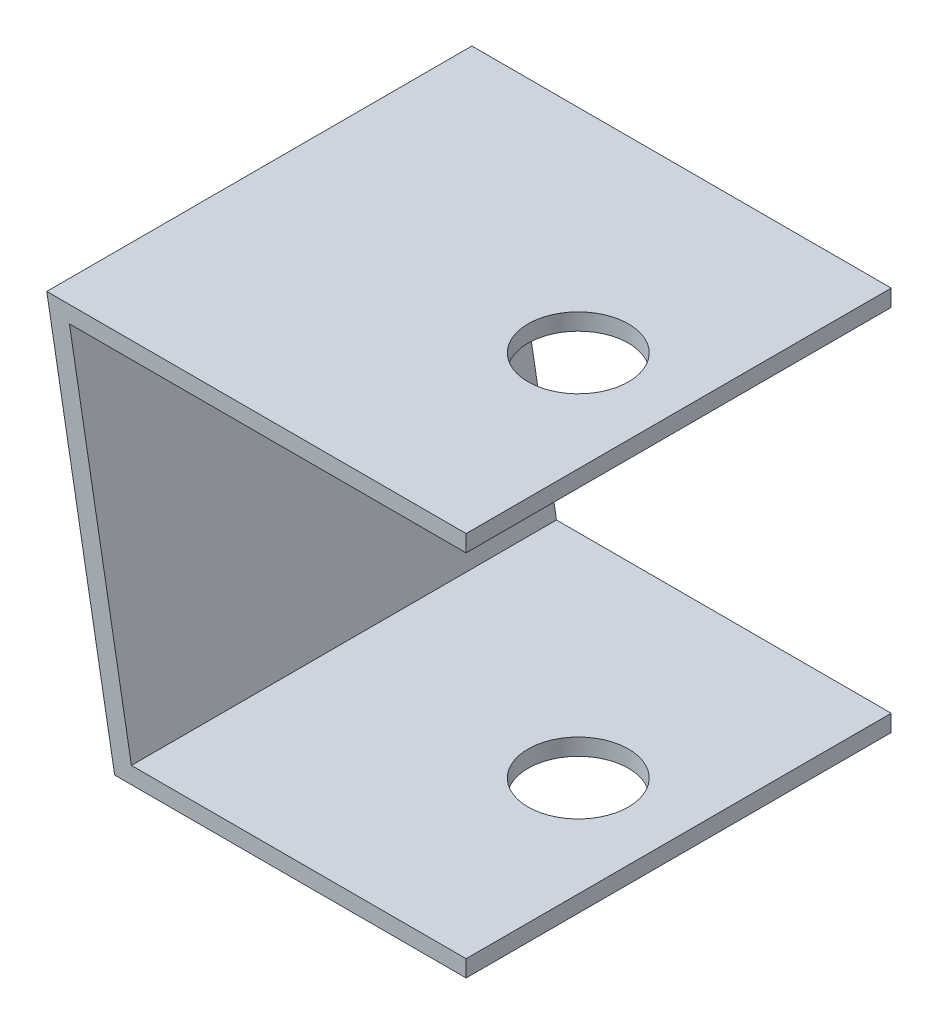
from build123d import *

# Parameters (mm, degrees)
BOSS_EXTRUDE1_DEPTH = 31.75
BOSS_EXTRUDE3_DEPTH = 63.5
CUT_EXTRUDE1_DEPTH  = 175.52526199
SKETCH4_R           = 7.5
CUT_EXTRUDE2_DEPTH  = 82.140420864


with BuildPart() as part:
    # Sketch1 → Boss-Extrude1 (new, symmetric)
    with BuildSketch(Plane.XY):
        Polygon((15, 152.926386675), (-35, 152.926386675), (-35, 100.426386675), (15, 100.426386675), (15, 97.926386675), (-37.5, 97.926386675), (-37.5, 155.426386675), (15, 155.426386675), align=None)
    extrude(amount=BOSS_EXTRUDE1_DEPTH, both=True)

    # Sketch2 → Boss-Extrude3 (add)
    with BuildSketch(Plane.XY.offset(31.75)):
        Polygon((-37.5, 97.926386675), (-47.638801391, 155.426386675), (-37.5, 155.426386675), align=None)
    extrude(amount=-BOSS_EXTRUDE3_DEPTH)

    # Sketch3 → Cut-Extrude1 (cut, through all)
    with BuildSketch(Plane.XY.offset(31.75)):
        Polygon((-35, 152.926386675), (-44.257166487, 152.926386675), (-35, 100.426386675), align=None)
    extrude(amount=-CUT_EXTRUDE1_DEPTH, mode=Mode.SUBTRACT)

    # Sketch4 → Cut-Extrude2 (cut, through all)
    with BuildSketch(Plane(origin=(0, 155.426386675, 0), x_dir=(1, 0, 0), z_dir=(0, 1, 0))):
        with Locations(Location((0, 0, 0), (0, 0, 270))):
            Circle(SKETCH4_R)
    extrude(amount=-CUT_EXTRUDE2_DEPTH, mode=Mode.SUBTRACT)


solid = part.part
